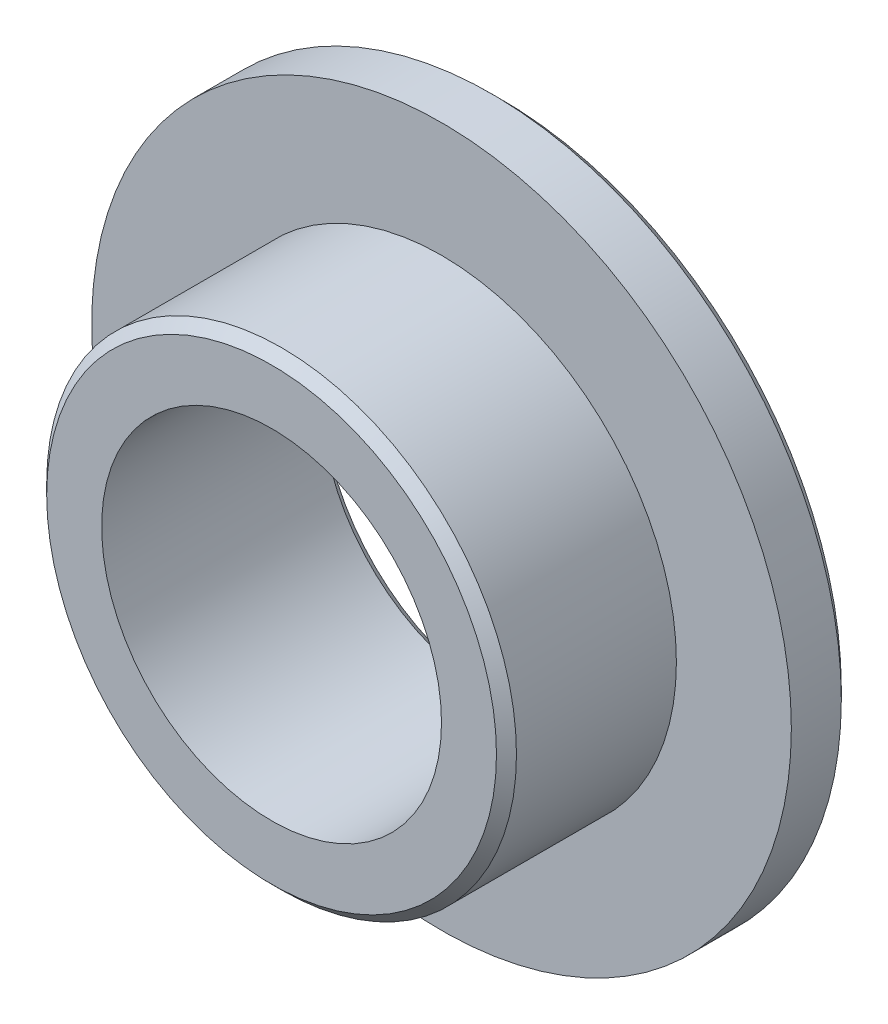
from build123d import *

# Parameters (mm, degrees)
SCHIZZO1_R        = 17.5
ESTRUSIONE1_DEPTH = 3
SCHIZZO2_R        = 11.75
ESTRUSIONE2_DEPTH = 8.5
SCHIZZO3_R        = 8.5
ESTRUSIONE3_DEPTH = 28.290108098
SMUSSO1_SIZE      = 0.5


with BuildPart() as part:
    # Schizzo1 → Estrusione1 (new body)
    with BuildSketch(Plane.XY):
        Circle(SCHIZZO1_R)
    extrude(amount=ESTRUSIONE1_DEPTH)

    # Schizzo2 → Estrusione2 (add)
    with BuildSketch(Plane.XY.offset(3)):
        Circle(SCHIZZO2_R)
    extrude(amount=ESTRUSIONE2_DEPTH)

    # Schizzo3 → Estrusione3 (cut, through all)
    with BuildSketch(Plane.XY.offset(11.5)):
        Circle(SCHIZZO3_R)
    extrude(amount=-ESTRUSIONE3_DEPTH, mode=Mode.SUBTRACT)

    # Smusso1
    smusso1_edges = [part.edges().sort_by_distance(p)[0] for p in [
        (-8.5, 0, 0),
        (-17.5, 0, 0),
        (-11.75, 0, 11.5),
    ]]
    chamfer(smusso1_edges, length=SMUSSO1_SIZE)


solid = part.part
